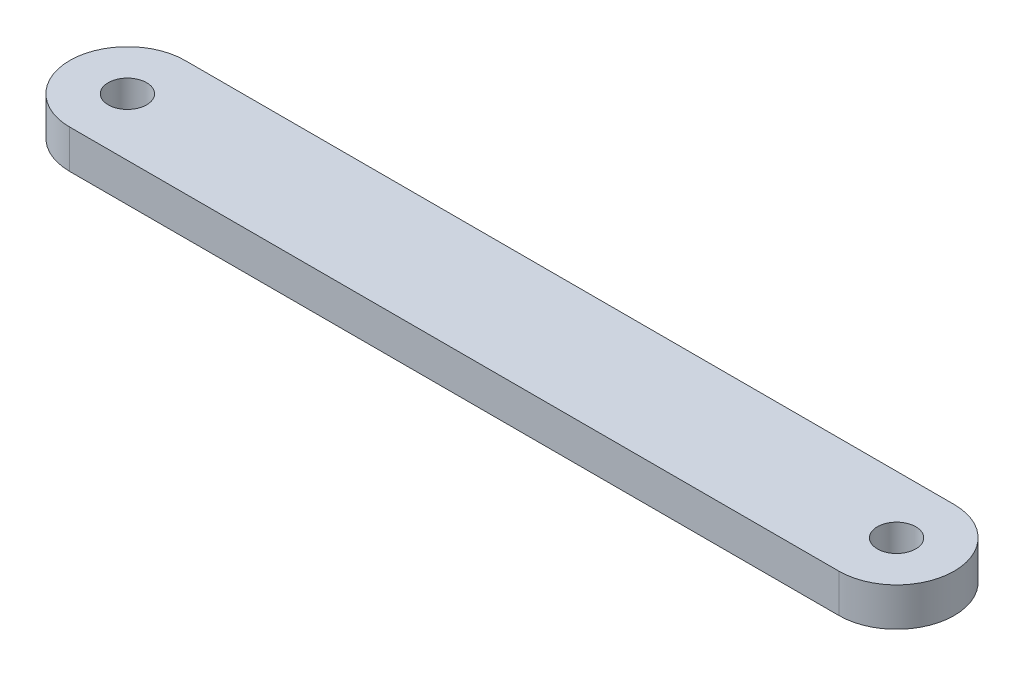
from build123d import *

# Parameters (mm, degrees)
SKETCH1_R           = 2.5
BOSS_EXTRUDE1_DEPTH = 5


with BuildPart() as part:
    # Sketch1 → Boss-Extrude1 (new body)
    with BuildSketch(Plane(origin=(0, 0, 0), x_dir=(1, 0, 0), z_dir=(0, 1, 0))):
        with BuildLine():
            Line((-50, 7.5), (50, 7.5))
            ThreePointArc((50, 7.5), (57.5, 0), (50, -7.5))
            Line((50, -7.5), (-50, -7.5))
            ThreePointArc((-50, -7.5), (-57.5, 0), (-50, 7.5))
        make_face()
        with Locations(Location((-50, 0, 0), (0, 0, 270))):
            Circle(SKETCH1_R, mode=Mode.SUBTRACT)
        with Locations(Location((50, 0, 0), (0, 0, 270))):
            Circle(SKETCH1_R, mode=Mode.SUBTRACT)
    extrude(amount=BOSS_EXTRUDE1_DEPTH)


solid = part.part
